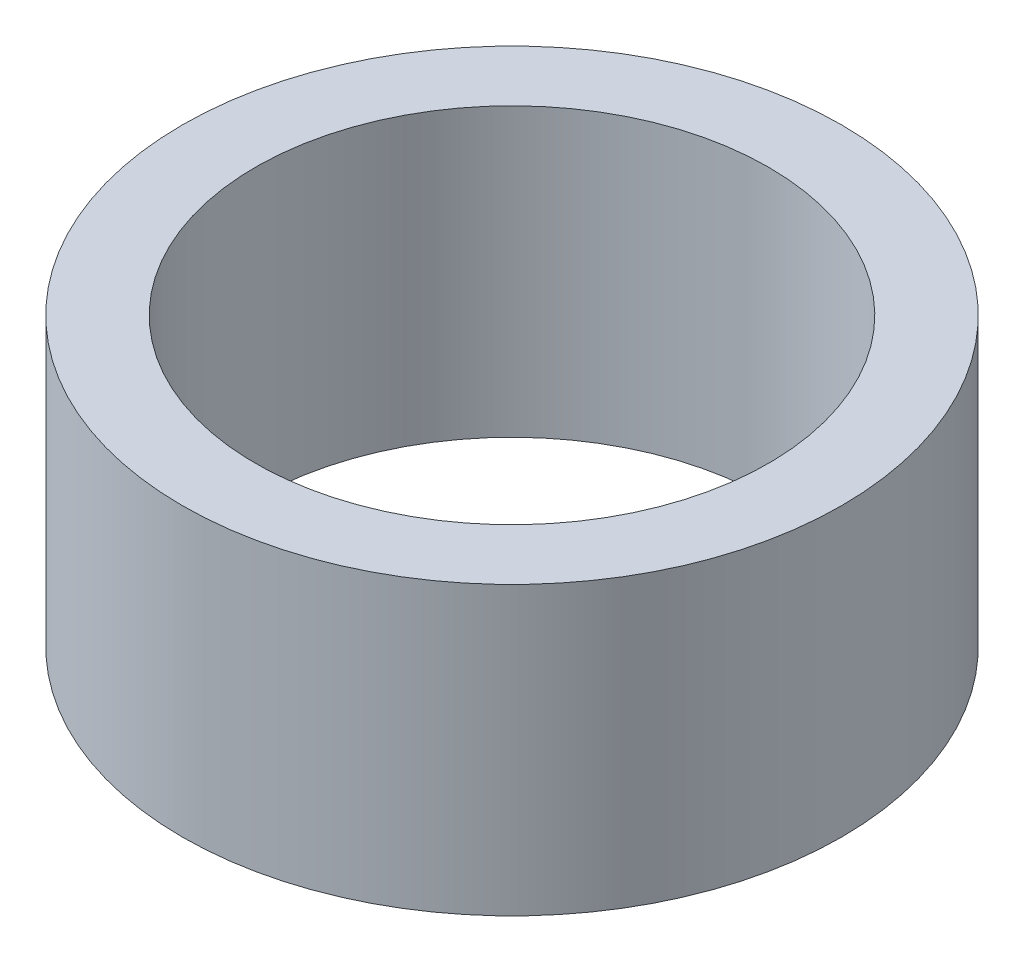
from build123d import *

# Parameters (mm, degrees)
SKETCH1_R           = 5.3975
SKETCH1_R_2         = 4.19989
BOSS_EXTRUDE1_DEPTH = 4.699499999


with BuildPart() as part:
    # Sketch1 → Boss-Extrude1 (new body)
    with BuildSketch(Plane(origin=(0, 0, 0), x_dir=(1, 0, 0), z_dir=(0, 1, 0))):
        with Locations(Location((0, 0, 0), (0, 0, 90))):
            Circle(SKETCH1_R)
        with Locations(Location((0, 0, 0), (0, 0, 90))):
            Circle(SKETCH1_R_2, mode=Mode.SUBTRACT)
    extrude(amount=BOSS_EXTRUDE1_DEPTH)


solid = part.part
